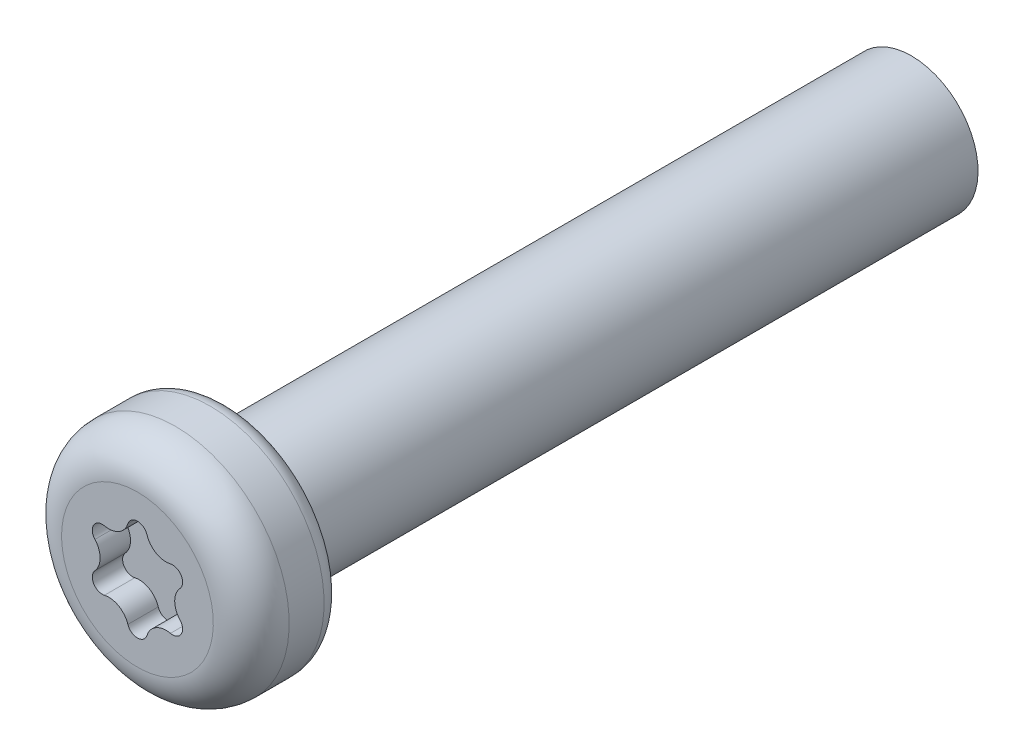
from build123d import *

# Parameters (mm, degrees)
SKETCH17_W         = 12
SKETCH17_H         = 1.17
SKETCH1_R          = 2
EXTRUDE3_DEPTH     = 1.6
CUT_EXTRUDE1_DEPTH = 0.533333333
CIRPATTERN1_COUNT  = 6


with BuildPart() as part:
    # Sketch17 → Revolve1 (revolve)
    with BuildSketch(Plane(origin=(0, 0, 0), x_dir=(0, 0, -1), z_dir=(1, 0, 0))):
        with Locations((6, 0.585)):
            Rectangle(SKETCH17_W, SKETCH17_H)
    revolve(axis=Axis((0, 0, 0), (0, 0, 1)))

    # Sketch1 → Extrude3 (add)
    with BuildSketch(Plane.XY):
        Circle(SKETCH1_R)
    extrude(amount=EXTRUDE3_DEPTH)

    # Sketch11 → Cut-Revolve3 (revolve, cut)
    with BuildSketch(Plane(origin=(0, 0, 0), x_dir=(0, 0, -1), z_dir=(1, 0, 0))):
        with BuildLine():
            Line((-0.933333333, 2), (-0.32, 2))
            ThreePointArc((-0.32, 2), (-0.09372583, 1.90627417), (0, 1.68))
            Line((0, 1.68), (0.254, 1.68))
            Line((0.254, 1.68), (0.254, 2.254))
            Line((0.254, 2.254), (-1.854, 2.254))
            Line((-1.854, 2.254), (-1.854, 1.333333333))
            Line((-1.854, 1.333333333), (-1.6, 1.333333333))
            ThreePointArc((-1.6, 1.333333333), (-1.404737854, 1.804737854), (-0.933333333, 2))
        make_face()
    revolve(axis=Axis((0, 0, 0), (0, 0, 1)), mode=Mode.SUBTRACT)

    # Sketch12 → Cut-Extrude1 (cut)
    with BuildSketch(Plane.XY.offset(1.6)):
        with BuildLine():
            Line((-0.327453492, 0.567166085), (0, 0))
            Line((0, 0), (0.327453492, 0.567166085))
            ThreePointArc((0.327453492, 0.567166085), (0.229009756, 0.651587798), (0.167817831, 0.765928268))
            ThreePointArc((0.167817831, 0.765928268), (0, 0.888888889), (-0.167817831, 0.765928268))
            ThreePointArc((-0.167817831, 0.765928268), (-0.229009756, 0.651587798), (-0.327453492, 0.567166085))
        make_face()
    cut_extrude1 = extrude(amount=-CUT_EXTRUDE1_DEPTH, mode=Mode.SUBTRACT)

    # CirPattern1: Cut-Extrude1 ×6 about axis
    cirpattern1_axis = Axis((0, 0, 0), (0, 0, -1))
    for i in range(1, CIRPATTERN1_COUNT):
        add(cut_extrude1.rotate(cirpattern1_axis, i * 360 / CIRPATTERN1_COUNT), mode=Mode.SUBTRACT)


solid = part.part
